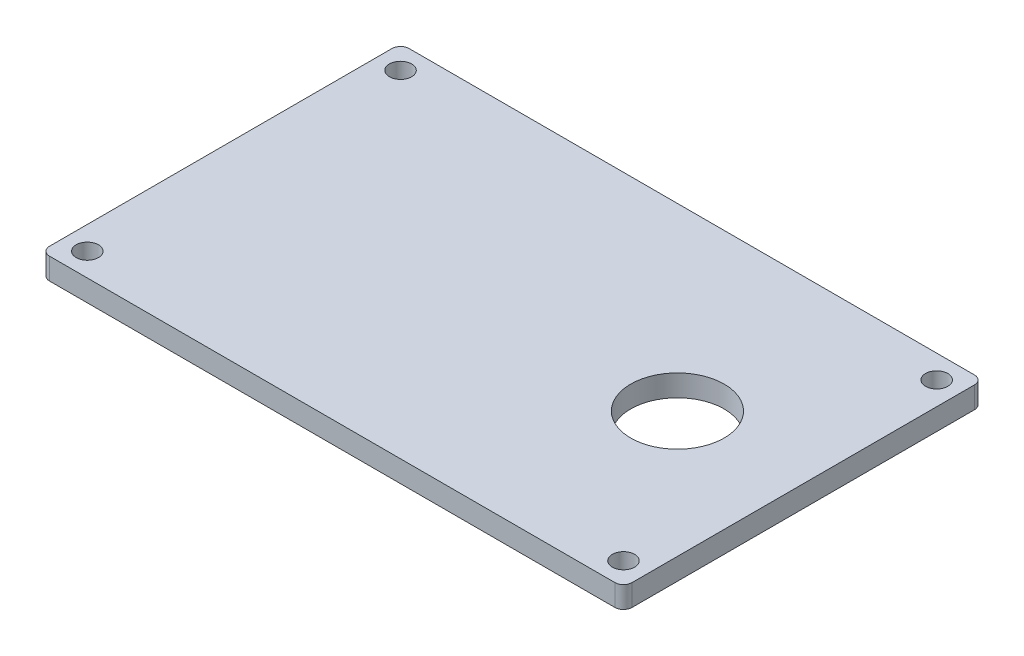
from build123d import *

# Parameters (mm, degrees)
SKETCH_1_R          = 1.55
EXTRUDE_1_DEPTH     = 3
SKETCH_2_R          = 6.5
CUT_EXTRUDE_1_DEPTH = 48.689097286


with BuildPart() as part:
    # 草圖1 → 填料-伸長1 (new body)
    with BuildSketch(Plane(origin=(0, 0, 0), x_dir=(1, 0, 0), z_dir=(0, 1, 0))):
        with BuildLine():
            Line((-39.3, -25), (39.3, -25))
            ThreePointArc((39.3, -25), (40.148528137, -24.648528137), (40.5, -23.8))
            Line((40.5, -23.8), (40.5, 23.8))
            ThreePointArc((40.5, 23.8), (40.148528137, 24.648528137), (39.3, 25))
            Line((39.3, 25), (-39.3, 25))
            ThreePointArc((-39.3, 25), (-40.148528137, 24.648528137), (-40.5, 23.8))
            Line((-40.5, 23.8), (-40.5, -23.8))
            ThreePointArc((-40.5, -23.8), (-40.148528137, -24.648528137), (-39.3, -25))
        make_face()
        with Locations(Location((-37.275, 21.775, 0), (0, 0, 270))):
            Circle(SKETCH_1_R, mode=Mode.SUBTRACT)
        with Locations(Location((37.275, 21.775, 0), (0, 0, 270))):
            Circle(SKETCH_1_R, mode=Mode.SUBTRACT)
        with Locations(Location((37.275, -21.775, 0), (0, 0, 270))):
            Circle(SKETCH_1_R, mode=Mode.SUBTRACT)
        with Locations(Location((-37.275, -21.775, 0), (0, 0, 270))):
            Circle(SKETCH_1_R, mode=Mode.SUBTRACT)
    extrude(amount=EXTRUDE_1_DEPTH)

    # 草圖2 → 除料-伸長1 (cut, through all)
    with BuildSketch(Plane.XZ):
        with Locations(Location((23, 0, 0), (0, 0, 270))):
            Circle(SKETCH_2_R)
    extrude(amount=-CUT_EXTRUDE_1_DEPTH, mode=Mode.SUBTRACT)


solid = part.part
